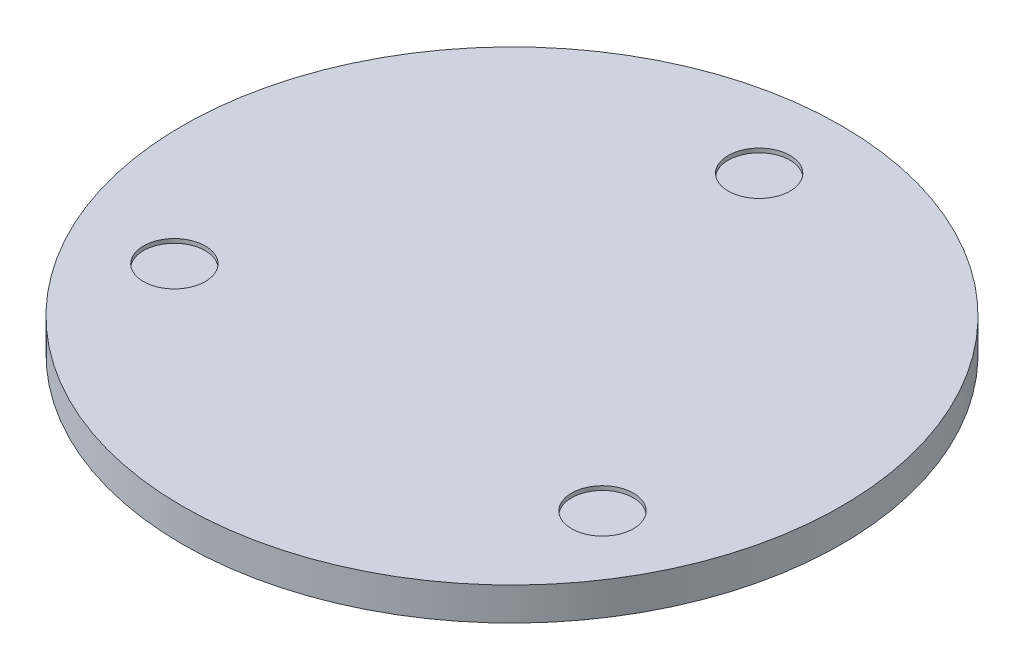
from build123d import *

# Parameters (mm, degrees)
CUT_EXTRUDE1_DEPTH = 0.635
SKETCH4_R          = 4.7625
CUT_EXTRUDE2_DEPTH = 0.635


with BuildPart() as part:
    # Sketch1 → Revolve1 (revolve)
    with BuildSketch(Plane.XY, mode=Mode.PRIVATE) as revolve1_sk:
        Polygon((-38.1, -2.54), (0, -2.54), (0, 0), (-50.8, 0), (-50.8, -5.08), (-38.1, -5.08), align=None)
    revolve(revolve1_sk.sketch.rotate(Axis((0, 4.567685351, 0), (0, -1, 0)), 270), axis=Axis((0, 4.567685351, 0), (0, -1, 0)))

    # Sketch3 → Cut-Extrude1 (cut)
    with BuildSketch(Plane(origin=(0, 0, 0), x_dir=(1, 0, 0), z_dir=(0, 1, 0))):
        Polygon((-1.833087105, 41.275), (-3.666174209, 38.1), (-1.833087105, 34.925), (1.833087105, 34.925), (3.666174209, 38.1), (1.833087105, 41.275), align=None)
        Polygon((-34.828654989, -15.875), (-36.661742094, -19.05), (-34.828654989, -22.225), (-31.16248078, -22.225), (-29.329393675, -19.05), (-31.16248078, -15.875), align=None)
        Polygon((34.828654989, -15.875), (31.16248078, -15.875), (29.329393675, -19.05), (31.16248078, -22.225), (34.828654989, -22.225), (36.661742094, -19.05), align=None)
    extrude(amount=-CUT_EXTRUDE1_DEPTH, mode=Mode.SUBTRACT)

    # Sketch4 → Cut-Extrude2 (cut)
    with BuildSketch(Plane(origin=(0, 0, 0), x_dir=(1, 0, 0), z_dir=(0, 1, 0))):
        with Locations(Location((32.995567884, -19.05, 0), (0, 0, 270))):
            Circle(SKETCH4_R)
        with Locations(Location((-32.995567884, -19.05, 0), (0, 0, 270))):
            Circle(SKETCH4_R)
        with Locations(Location((0, 38.1, 0), (0, 0, 270))):
            Circle(SKETCH4_R)
    extrude(amount=-CUT_EXTRUDE2_DEPTH, mode=Mode.SUBTRACT)


solid = part.part
